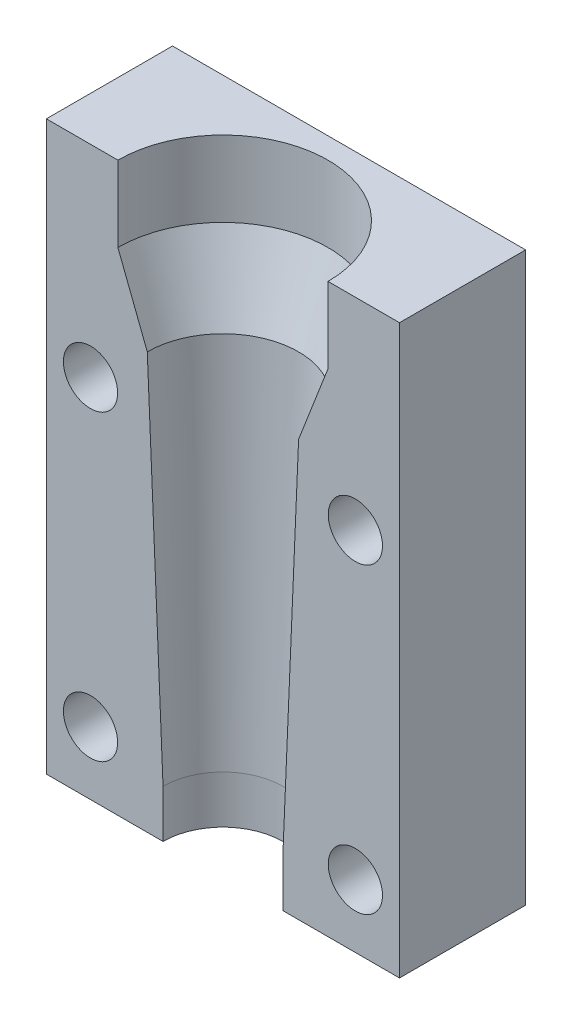
from build123d import *

# Parameters (mm, degrees)
SKETCH4_W           = 28
SKETCH4_H           = 45
BOSS_EXTRUDE2_DEPTH = 10
SKETCH6_R           = 2.15
CUT_EXTRUDE1_DEPTH  = 6
SKETCH7_R           = 2.75
CUT_EXTRUDE2_DEPTH  = 6


with BuildPart() as part:
    # Sketch4 → Boss-Extrude2 (new body)
    with BuildSketch(Plane.XY):
        Rectangle(SKETCH4_W, SKETCH4_H)
    extrude(amount=BOSS_EXTRUDE2_DEPTH)

    # Sketch5 → Cut-Revolve1 (revolve, cut)
    with BuildSketch(Plane.XY.offset(10)):
        Polygon((0, 22.5), (8.33, 22.5), (8.33, 16.5), (6, 10.5), (4.75, -18.71), (4.75, -22.5), (0, -22.5), align=None)
    revolve(axis=Axis((0, 0, 10), (0, 1, 0)), mode=Mode.SUBTRACT)

    # Sketch6 → Cut-Extrude1 (cut)
    with BuildSketch(Plane.XY.offset(10)):
        with Locations((-10.5, 6.5)):
            Circle(SKETCH6_R)
        with Locations((-10.5, -17.5)):
            Circle(SKETCH6_R)
        with Locations((10.5, 6.5)):
            Circle(SKETCH6_R)
        with Locations((10.5, -17.5)):
            Circle(SKETCH6_R)
    extrude(amount=-CUT_EXTRUDE1_DEPTH, mode=Mode.SUBTRACT)

    # Sketch7 → Cut-Extrude2 (cut)
    with BuildSketch(Plane(origin=(0, 0, 0), x_dir=(-1, 0, 0), z_dir=(0, 0, -1))):
        with Locations((-10, 12.5)):
            Circle(SKETCH7_R)
        with Locations((10, 12.5)):
            Circle(SKETCH7_R)
    extrude(amount=-CUT_EXTRUDE2_DEPTH, mode=Mode.SUBTRACT)


solid = part.part
